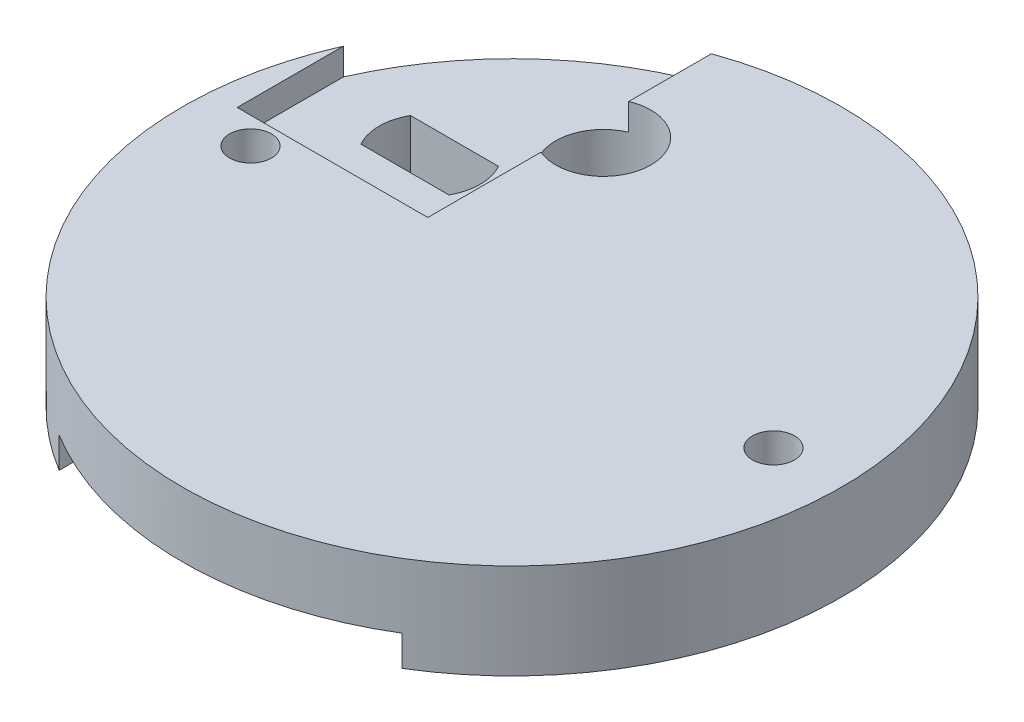
from build123d import *

# Parameters (mm, degrees)
SKETCH_1_R          = 17.29
SKETCH_1_R_2        = 1.1
SKETCH_1_R_3        = 2.5
EXTRUDE_1_DEPTH     = 4
SKETCH_2_W          = 4
SKETCH_2_H          = 4.8
SKETCH_2_H_2        = 3.4
SKETCH_2_W_2        = 4.4
SKETCH_2_H_3        = 4
SKETCH_2_W_3        = 18
SKETCH_2_H_4        = 12
CUT_EXTRUDE_1_DEPTH = 1.6
SKETCH_3_R          = 17.29
SKETCH_3_R_2        = 2.5
SKETCH_3_R_3        = 1.1
EXTRUDE_2_DEPTH     = 1
SKETCH_4_W          = 10
SKETCH_4_H          = 15
CUT_EXTRUDE_2_DEPTH = 1.4


with BuildPart() as part:
    # 草图1 → 凸台-拉伸1 (new body)
    with BuildSketch(Plane(origin=(0, 0, 0), x_dir=(1, 0, 0), z_dir=(0, 1, 0))):
        with Locations(Location((0, 0, 0), (0, 0, 270))):
            Circle(SKETCH_1_R)
        with Locations(Location((-13.72, 0, 0), (0, 0, 270))):
            Circle(SKETCH_1_R_2, mode=Mode.SUBTRACT)
        with Locations(Location((13.72, 0, 0), (0, 0, 270))):
            Circle(SKETCH_1_R_2, mode=Mode.SUBTRACT)
        with Locations(Location((-4.85, 9.64, 0), (0, 0, 270))):
            Circle(SKETCH_1_R_3, mode=Mode.SUBTRACT)
        with BuildLine():
            Line((-12.309220648, 6.98), (-7.690779352, 6.98))
            ThreePointArc((-7.690779352, 6.98), (-7.35, 5.68), (-7.690779352, 4.38))
            Line((-7.690779352, 4.38), (-12.309220648, 4.38))
            ThreePointArc((-12.309220648, 4.38), (-12.65, 5.68), (-12.309220648, 6.98))
        make_face(mode=Mode.SUBTRACT)
        with BuildLine():
            Line((12.309220648, 6.98), (7.690779352, 6.98))
            ThreePointArc((7.690779352, 6.98), (7.35, 5.68), (7.690779352, 4.38))
            Line((7.690779352, 4.38), (12.309220648, 4.38))
            ThreePointArc((12.309220648, 4.38), (12.65, 5.68), (12.309220648, 6.98))
        make_face(mode=Mode.SUBTRACT)
    extrude(amount=EXTRUDE_1_DEPTH)

    # 草图2 → 切除-拉伸1 (cut)
    with BuildSketch(Plane.XZ):
        with Locations((-7.22, 0.9)):
            Rectangle(SKETCH_2_W, SKETCH_2_H)
        with Locations((8, -1.1)):
            Rectangle(SKETCH_2_W, SKETCH_2_H_2)
        with Locations((-14.996048965, 3.8)):
            Rectangle(SKETCH_2_W_2, SKETCH_2_H_3)
        with Locations((0, 11.29)):
            Rectangle(SKETCH_2_W_3, SKETCH_2_H_4)
    extrude(amount=-CUT_EXTRUDE_1_DEPTH, mode=Mode.SUBTRACT)

    # 草图3 → 凸台-拉伸2 (add)
    with BuildSketch(Plane(origin=(0, 4, 0), x_dir=(1, 0, 0), z_dir=(0, 1, 0))):
        with Locations(Location((0, 0, 0), (0, 0, 185.97568604))):
            Circle(SKETCH_3_R)
        with Locations(Location((-4.85, 9.64, 0), (0, 0, 270))):
            Circle(SKETCH_3_R_2, mode=Mode.SUBTRACT)
        with Locations(Location((-13.72, 0, 0), (0, 0, 270))):
            Circle(SKETCH_3_R_3, mode=Mode.SUBTRACT)
        with Locations(Location((13.72, 0, 0), (0, 0, 270))):
            Circle(SKETCH_3_R_3, mode=Mode.SUBTRACT)
    extrude(amount=EXTRUDE_2_DEPTH)

    # 草图4 → 切除-拉伸2 (cut)
    with BuildSketch(Plane(origin=(0, 5, 0), x_dir=(1, 0, 0), z_dir=(0, 1, 0))):
        with Locations((-10.82, 8.9)):
            Rectangle(SKETCH_4_W, SKETCH_4_H)
    extrude(amount=-CUT_EXTRUDE_2_DEPTH, mode=Mode.SUBTRACT)


solid = part.part
